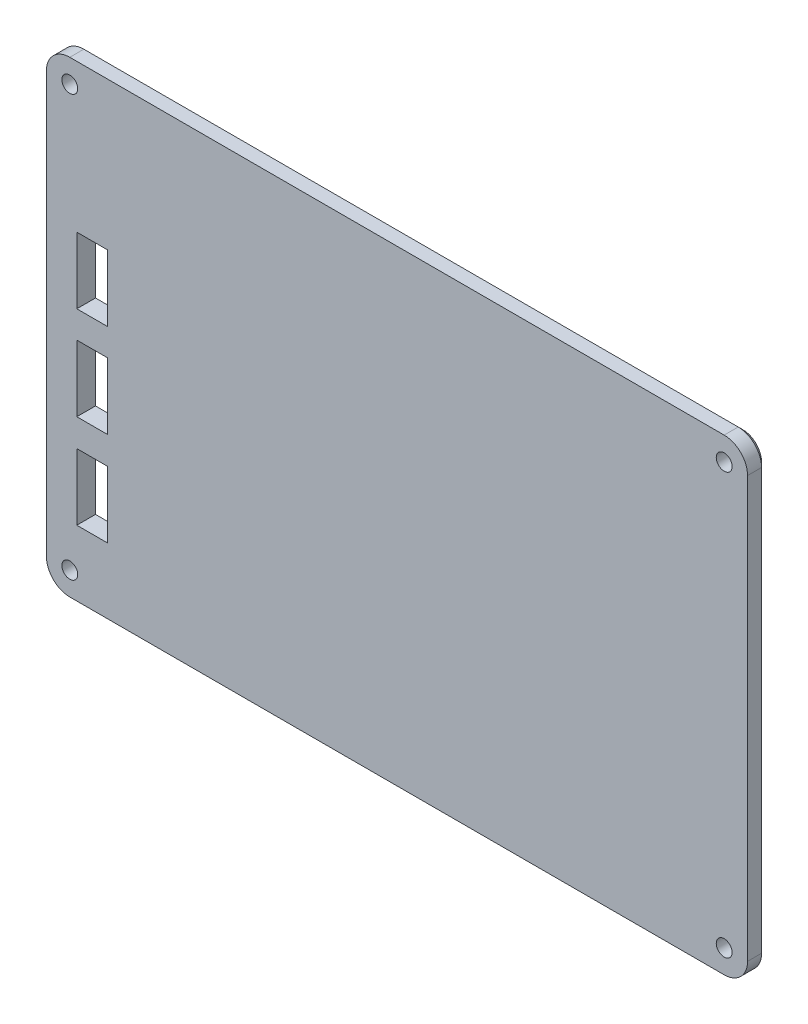
from build123d import *

# Parameters (mm, degrees)
P_IDAT_VYSUNUT_M1_DEPTH                           = 4
KU_ELOV_ZAHLOUBEN_PRO_M3_ROUBU_SE_Z_P_D           = 3.4
KU_ELOV_ZAHLOUBEN_PRO_M3_ROUBU_SE_Z_P_CSINK_D     = 6.3
KU_ELOV_ZAHLOUBEN_PRO_M3_ROUBU_SE_Z_P_CSINK_ANGLE = 90
ZKOSEN_1_SIZE                                     = 1
SKICA4_W                                          = 6.6
SKICA4_H                                          = 14.2
ODEBRAT_VYSUNUT_M1_DEPTH                          = 91.589306764


with BuildPart() as part:
    # Skica1 → Přidat vysunutím1 (new body)
    with BuildSketch(Plane(origin=(0, 0, -86), x_dir=(-1, 0, 0), z_dir=(0, 0, -1))):
        with BuildLine():
            Line((-75, 44.35), (-75, -45.65))
            ThreePointArc((-75, -45.65), (-73.535533906, -49.185533906), (-70, -50.65))
            Line((-70, -50.65), (70, -50.65))
            ThreePointArc((70, -50.65), (73.535533906, -49.185533906), (75, -45.65))
            Line((75, -45.65), (75, 44.35))
            ThreePointArc((75, 44.35), (73.535533906, 47.885533906), (70, 49.35))
            Line((70, 49.35), (-70, 49.35))
            ThreePointArc((-70, 49.35), (-73.535533906, 47.885533906), (-75, 44.35))
        make_face()
    extrude(amount=P_IDAT_VYSUNUT_M1_DEPTH)

    # Kuželové zahloubení pro M3 šroubu se zápustnou hlavou plochou1 (through all)
    with Locations(Plane(origin=(0, 0, -90), x_dir=(-1, 0, 0), z_dir=(0, 0, -1))):
        with Locations((70, -45.657811951), (70, 44.357811951), (-70, 44.357811951), (-70, -45.657811951)):
            CounterSinkHole(KU_ELOV_ZAHLOUBEN_PRO_M3_ROUBU_SE_Z_P_D / 2, KU_ELOV_ZAHLOUBEN_PRO_M3_ROUBU_SE_Z_P_CSINK_D / 2, counter_sink_angle=KU_ELOV_ZAHLOUBEN_PRO_M3_ROUBU_SE_Z_P_CSINK_ANGLE)

    # Zkosení1
    zkosen_1_edges = [part.edges().sort_by_distance(p)[0] for p in [
        (73.535533906, -49.185533906, -90),
        (0, -50.65, -90),
        (-73.535533906, -49.185533906, -90),
        (-75, -0.65, -90),
        (-73.535533906, 47.885533906, -90),
        (0, 49.35, -90),
        (73.535533906, 47.885533906, -90),
        (75, -0.65, -90),
    ]]
    chamfer(zkosen_1_edges, length=ZKOSEN_1_SIZE)

    # Skica4 → Odebrat vysunutím1 (cut, through all)
    with BuildSketch(Plane(origin=(0, 0, -90), x_dir=(-1, 0, 0), z_dir=(0, 0, -1))):
        with Locations((65.2, -29.5)):
            Rectangle(SKICA4_W, SKICA4_H)
        with Locations((65.2, -9.4)):
            Rectangle(SKICA4_W, SKICA4_H)
        with Locations((65.2, 10.6)):
            Rectangle(SKICA4_W, SKICA4_H)
    extrude(amount=-ODEBRAT_VYSUNUT_M1_DEPTH, mode=Mode.SUBTRACT)


solid = part.part
